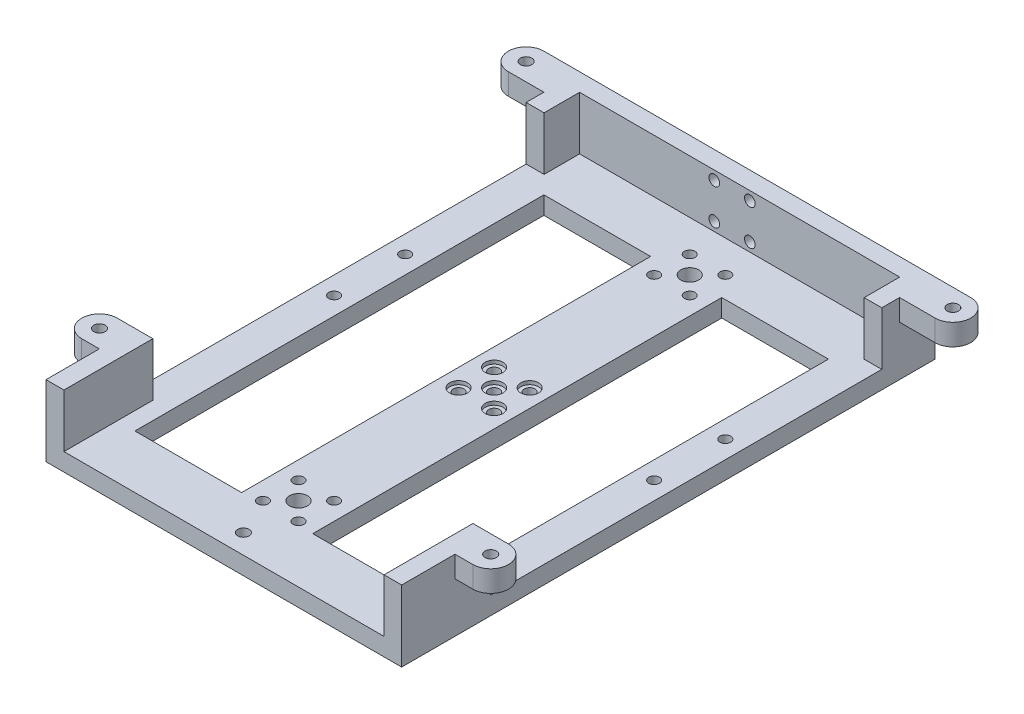
from build123d import *

# Parameters (mm, degrees)
SKETCH_2_W           = 100
SKETCH_2_H           = 40
EXTRUDE_1_DEPTH      = 150
SKETCH_3_W           = 90
SKETCH_3_H           = 32
CUT_EXTRUDE_1_DEPTH  = 145
SKETCH_4_W           = 30
SKETCH_4_H           = 115
CUT_EXTRUDE_2_DEPTH  = 20
SKETCH_5_W           = 35
SKETCH_5_H           = 115
CUT_EXTRUDE_3_DEPTH  = 20
SKETCH_6_W           = 120
SKETCH_6_H           = 31
CUT_EXTRUDE_4_DEPTH  = 207
SKETCH_7_R           = 1.5
CUT_EXTRUDE_5_DEPTH  = 15
SKETCH_8_R           = 2.5
CUT_EXTRUDE_6_DEPTH  = 15
SKETCH_11_W          = 100
SKETCH_11_H          = 150
CUT_EXTRUDE_7_DEPTH  = 20
SKETCH_12_R          = 1.6
EXTRUDE_3_DEPTH      = 6
SKETCH_13_W          = 4.955411511
SKETCH_13_H          = 10
SKETCH_13_W_2        = 5.044588489
EXTRUDE_4_DEPTH      = 10
SKETCH_15_R          = 1.6
CUT_EXTRUDE_8_DEPTH  = 10
SKETCH_16_R          = 1.5
SKETCH_16_R_2        = 2.5
CUT_EXTRUDE_9_DEPTH  = 10
SKETCH_17_R          = 1.5
CUT_EXTRUDE_10_DEPTH = 10
SKETCH_18_R          = 1.5
CUT_EXTRUDE_11_DEPTH = 10
SKETCH_19_R          = 2.5
CUT_EXTRUDE_12_DEPTH = 1
SKETCH_20_R          = 2.5
CUT_EXTRUDE_13_DEPTH = 1


with BuildPart() as part:
    # 草图2 → 凸台-拉伸1 (new body)
    with BuildSketch(Plane.XY):
        Rectangle(SKETCH_2_W, SKETCH_2_H)
    extrude(amount=EXTRUDE_1_DEPTH)

    # 草图3 → 切除-拉伸1 (cut)
    with BuildSketch(Plane.XY.offset(150)):
        with Locations((0.044588489, 1)):
            Rectangle(SKETCH_3_W, SKETCH_3_H)
    extrude(amount=-CUT_EXTRUDE_1_DEPTH, mode=Mode.SUBTRACT)

    # 草图4 → 切除-拉伸2 (cut)
    with BuildSketch(Plane.XZ.offset(20)):
        with Locations((-25, 77.5)):
            Rectangle(SKETCH_4_W, SKETCH_4_H)
        with Locations((25, 77.5)):
            Rectangle(SKETCH_4_W, SKETCH_4_H)
    extrude(amount=-CUT_EXTRUDE_2_DEPTH, mode=Mode.SUBTRACT)

    # 草图5 → 切除-拉伸3 (cut)
    with BuildSketch(Plane(origin=(0, 20, 0), x_dir=(1, 0, 0), z_dir=(0, 1, 0))):
        with Locations((-22.5, -77.5)):
            Rectangle(SKETCH_5_W, SKETCH_5_H)
        with Locations((22.5, -77.5)):
            Rectangle(SKETCH_5_W, SKETCH_5_H)
    extrude(amount=-CUT_EXTRUDE_3_DEPTH, mode=Mode.SUBTRACT)

    # 草图6 → 切除-拉伸4 (cut)
    with BuildSketch(Plane.ZY.offset(50)):
        with Locations((75, 0.5)):
            Rectangle(SKETCH_6_W, SKETCH_6_H)
    extrude(amount=-CUT_EXTRUDE_4_DEPTH, mode=Mode.SUBTRACT)

    # 草图7 → 切除-拉伸5 (cut)
    with BuildSketch(Plane.XZ.offset(20)):
        with Locations(Location((-5, 134, 0), (0, 0, 270))):
            Circle(SKETCH_7_R)
        with Locations(Location((5, 134, 0), (0, 0, 270))):
            Circle(SKETCH_7_R)
        with Locations(Location((5, 124, 0), (0, 0, 270))):
            Circle(SKETCH_7_R)
        with Locations(Location((-5, 124, 0), (0, 0, 270))):
            Circle(SKETCH_7_R)
    extrude(amount=-CUT_EXTRUDE_5_DEPTH, mode=Mode.SUBTRACT)

    # 草图8 → 切除-拉伸6 (cut)
    with BuildSketch(Plane.XZ.offset(20)):
        with Locations(Location((0, 129, 0), (0, 0, 270))):
            Circle(SKETCH_8_R)
    extrude(amount=-CUT_EXTRUDE_6_DEPTH, mode=Mode.SUBTRACT)

    # 草图11 → 切除-拉伸7 (cut)
    with BuildSketch(Plane(origin=(0, 20, 0), x_dir=(1, 0, 0), z_dir=(0, 1, 0))):
        with Locations((0, -75)):
            Rectangle(SKETCH_11_W, SKETCH_11_H)
    extrude(amount=-CUT_EXTRUDE_7_DEPTH, mode=Mode.SUBTRACT)

    # 草图12 → 凸台-拉伸3 (add)
    # profile 1 of 4: a face of its own
    with BuildSketch(Plane(origin=(0, 0, 0), x_dir=(1, 0, 0), z_dir=(0, 1, 0))):
        with BuildLine():
            Line((-50, 0), (-60, 0))
            ThreePointArc((-60, 0), (-65, -5), (-60, -10))
            Line((-60, -10), (-50, -10))
            Line((-50, -10), (-50, 0))
        make_face()
        with Locations(Location((-60, -5, 0), (0, 0, 270))):
            Circle(SKETCH_12_R, mode=Mode.SUBTRACT)
    # profile 2 of 4: a face of its own
    with BuildSketch(Plane(origin=(0, 0, 0), x_dir=(1, 0, 0), z_dir=(0, 1, 0))):
        with BuildLine():
            Line((50, 0), (50, -10))
            Line((50, -10), (60, -10))
            ThreePointArc((60, -10), (65, -5), (60, 0))
            Line((60, 0), (50, 0))
        make_face()
        with Locations(Location((60, -5, 0), (0, 0, 270))):
            Circle(SKETCH_12_R, mode=Mode.SUBTRACT)
    # profile 3 of 4: a face of its own
    with BuildSketch(Plane(origin=(0, 0, 0), x_dir=(1, 0, 0), z_dir=(0, 1, 0))):
        with BuildLine():
            Line((45.044588489, -125), (45.044588489, -135))
            Line((45.044588489, -135), (55.044588489, -135))
            ThreePointArc((55.044588489, -135), (60.044588489, -130), (55.044588489, -125))
            Line((55.044588489, -125), (45.044588489, -125))
        make_face()
        with Locations(Location((55.044588489, -130, 0), (0, 0, 270))):
            Circle(SKETCH_12_R, mode=Mode.SUBTRACT)
    # profile 4 of 4: a face of its own
    with BuildSketch(Plane(origin=(0, 0, 0), x_dir=(1, 0, 0), z_dir=(0, 1, 0))):
        with BuildLine():
            Line((-44.955411511, -125), (-44.955411511, -135))
            Line((-44.955411511, -135), (-54.955411511, -135))
            ThreePointArc((-54.955411511, -135), (-59.955411511, -130), (-54.955411511, -125))
            Line((-54.955411511, -125), (-44.955411511, -125))
        make_face()
        with Locations(Location((-54.955411511, -130, 0), (0, 0, 270))):
            Circle(SKETCH_12_R, mode=Mode.SUBTRACT)
    extrude(amount=-EXTRUDE_3_DEPTH)

    # 草图13 → 凸台-拉伸4 (add)
    with BuildSketch(Plane.XZ.offset(6)):
        with Locations((47.522294245, 130)):
            Rectangle(SKETCH_13_W, SKETCH_13_H)
        with Locations((-47.477705755, 130)):
            Rectangle(SKETCH_13_W_2, SKETCH_13_H)
    extrude(amount=EXTRUDE_4_DEPTH)

    # 草图15 → 切除-拉伸8 (cut)
    with BuildSketch(Plane.XZ.offset(20)):
        with Locations(Location((0, 144.5, 0), (0, 0, 270))):
            Circle(SKETCH_15_R)
    extrude(amount=-CUT_EXTRUDE_8_DEPTH, mode=Mode.SUBTRACT)

    # 草图16 → 切除-拉伸9 (cut)
    with BuildSketch(Plane(origin=(0, -15, 0), x_dir=(1, 0, 0), z_dir=(0, 1, 0))):
        with Locations(Location((0, -74, 0), (0, 0, 270))):
            Circle(SKETCH_16_R)
        with Locations(Location((0, -19, 0), (0, 0, 270))):
            Circle(SKETCH_16_R_2)
        with Locations(Location((-5, -14, 0), (0, 0, 270))):
            Circle(SKETCH_16_R)
        with Locations(Location((5, -14, 0), (0, 0, 270))):
            Circle(SKETCH_16_R)
        with Locations(Location((-5, -24, 0), (0, 0, 270))):
            Circle(SKETCH_16_R)
        with Locations(Location((5, -24, 0), (0, 0, 270))):
            Circle(SKETCH_16_R)
        with Locations(Location((-5, -69, 0), (0, 0, 270))):
            Circle(SKETCH_16_R)
        with Locations(Location((5, -69, 0), (0, 0, 270))):
            Circle(SKETCH_16_R)
        with Locations(Location((5, -79, 0), (0, 0, 270))):
            Circle(SKETCH_16_R)
        with Locations(Location((-5, -79, 0), (0, 0, 270))):
            Circle(SKETCH_16_R)
    extrude(amount=-CUT_EXTRUDE_9_DEPTH, mode=Mode.SUBTRACT)

    # 草图17 → 切除-拉伸10 (cut)
    with BuildSketch(Plane.XZ.offset(20)):
        with Locations(Location((-45, 74, 0), (0, 0, 270))):
            Circle(SKETCH_17_R)
        with Locations(Location((-45, 54, 0), (0, 0, 270))):
            Circle(SKETCH_17_R)
        with Locations(Location((45, 54, 0), (0, 0, 270))):
            Circle(SKETCH_17_R)
        with Locations(Location((45, 74, 0), (0, 0, 270))):
            Circle(SKETCH_17_R)
    extrude(amount=-CUT_EXTRUDE_10_DEPTH, mode=Mode.SUBTRACT)

    # 草图18 → 切除-拉伸11 (cut)
    with BuildSketch(Plane.XY.offset(5)):
        with Locations((-7.089720892, -2.5)):
            Circle(SKETCH_18_R)
        with Locations((2.910279108, -2.5)):
            Circle(SKETCH_18_R)
        with Locations((-7.089720892, -12.5)):
            Circle(SKETCH_18_R)
        with Locations((2.910279108, -12.5)):
            Circle(SKETCH_18_R)
    extrude(amount=-CUT_EXTRUDE_11_DEPTH, mode=Mode.SUBTRACT)

    # 草图19 → 切除-拉伸12 (cut)
    with BuildSketch(Plane(origin=(0, -15, 0), x_dir=(1, 0, 0), z_dir=(0, 1, 0))):
        with Locations(Location((5, -79, 0), (0, 0, 270))):
            Circle(SKETCH_19_R)
        with Locations(Location((-5, -79, 0), (0, 0, 270))):
            Circle(SKETCH_19_R)
        with Locations(Location((-5, -69, 0), (0, 0, 270))):
            Circle(SKETCH_19_R)
        with Locations(Location((5, -69, 0), (0, 0, 270))):
            Circle(SKETCH_19_R)
    extrude(amount=-CUT_EXTRUDE_12_DEPTH, mode=Mode.SUBTRACT)

    # 草图20 → 切除-拉伸13 (cut)
    with BuildSketch(Plane(origin=(0, -15, 0), x_dir=(1, 0, 0), z_dir=(0, 1, 0))):
        with Locations(Location((0, -74, 0), (0, 0, 270))):
            Circle(SKETCH_20_R)
    extrude(amount=-CUT_EXTRUDE_13_DEPTH, mode=Mode.SUBTRACT)


solid = part.part
